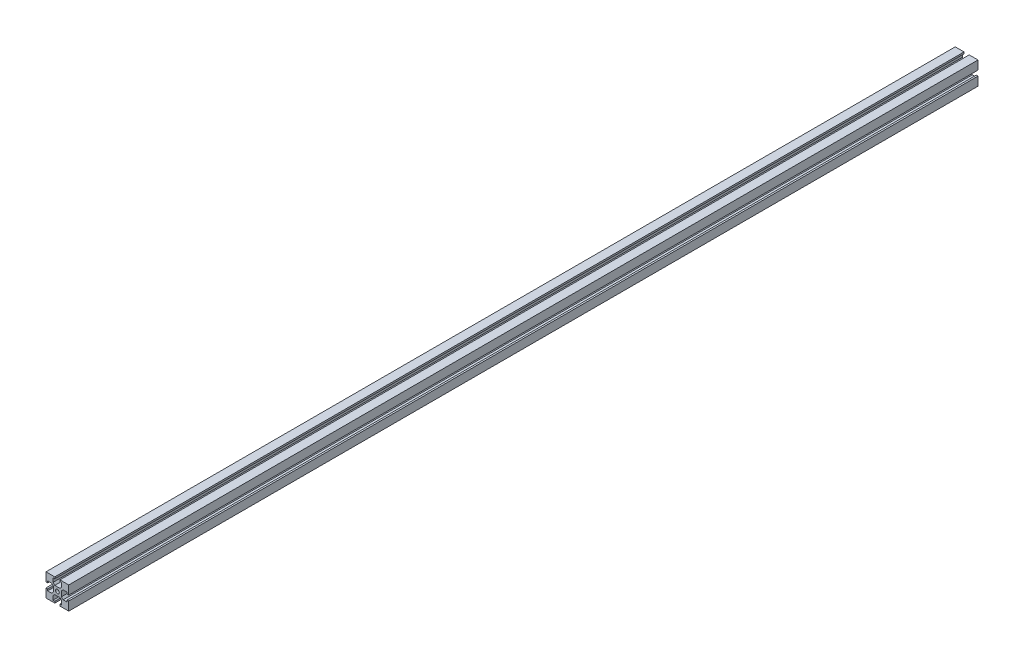
from build123d import *

# Parameters (mm, degrees)
SKETCH_2_R      = 1.25
EXTRUDE_1_DEPTH = 600


with BuildPart() as part:
    # ｽｹｯﾁ2 → ﾎﾞｽ - 押し出し1 (new body)
    with BuildSketch(Plane.XY):
        Polygon((1.7, 2.65), (-1.7, 2.65), (-2.85, 3.8), (-2.85, 6.4), (-1.7, 6.4), (-1.7, 7.5), (-7.5, 7.5), (-7.5, 1.7), (-6.4, 1.7), (-6.4, 2.85), (-3.8, 2.85), (-2.65, 1.7), (-2.65, -1.7), (-3.8, -2.85), (-6.4, -2.85), (-6.4, -1.7), (-7.5, -1.7), (-7.5, -7.5), (-1.7, -7.5), (-1.7, -6.4), (-2.85, -6.4), (-2.85, -3.8), (-1.7, -2.65), (1.7, -2.65), (2.85, -3.8), (2.85, -6.4), (1.7, -6.4), (1.7, -7.5), (7.5, -7.5), (7.5, -1.7), (6.4, -1.7), (6.4, -2.85), (3.8, -2.85), (2.65, -1.7), (2.65, 1.7), (3.8, 2.85), (6.4, 2.85), (6.4, 1.7), (7.5, 1.7), (7.5, 7.5), (1.7, 7.5), (1.7, 6.4), (2.85, 6.4), (2.85, 3.8), align=None)
        Circle(SKETCH_2_R, mode=Mode.SUBTRACT)
    extrude(amount=EXTRUDE_1_DEPTH)


solid = part.part
